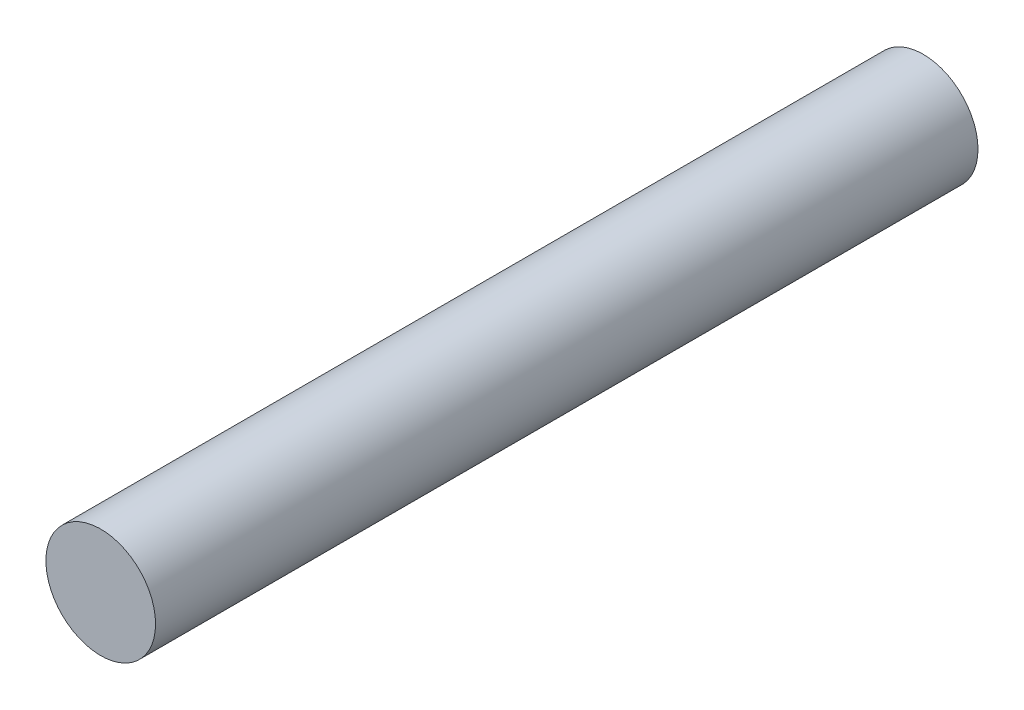
from build123d import *

# Parameters (mm, degrees)
SKETCH_1_R      = 10
EXTRUDE_1_DEPTH = 150


with BuildPart() as part:
    # 草图1 → 凸台-拉伸1 (new body)
    with BuildSketch(Plane.XY):
        Circle(SKETCH_1_R)
    extrude(amount=EXTRUDE_1_DEPTH)


solid = part.part
